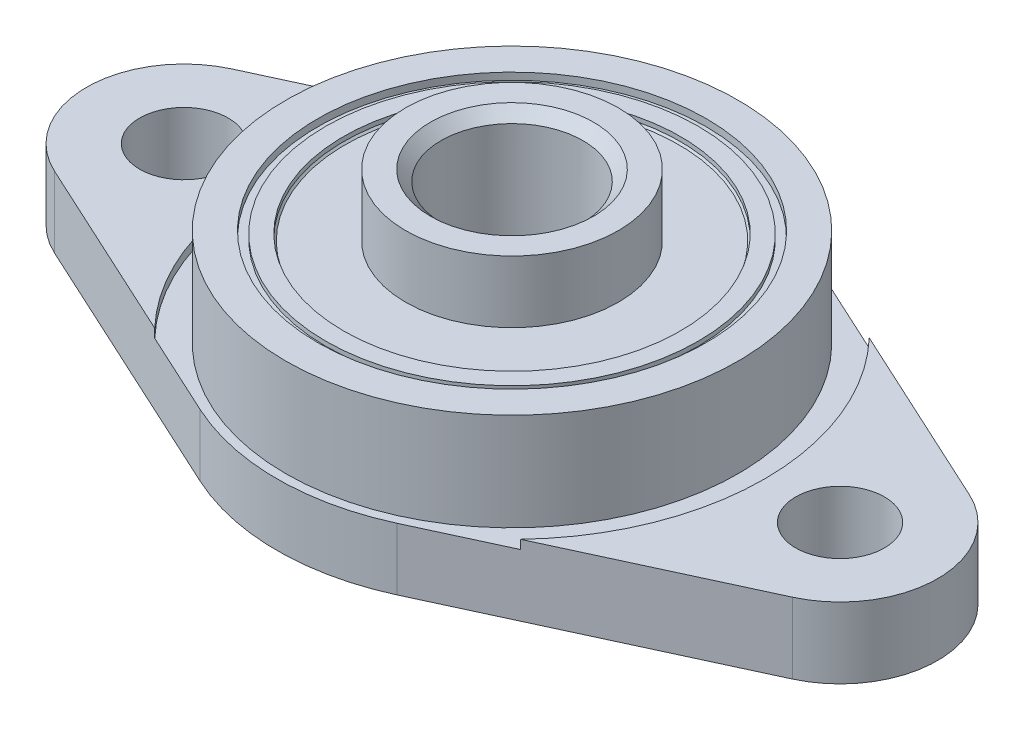
from build123d import *

# Parameters (mm, degrees)
SKETCH2_R               = 2.5
BOSS_EXTRUDE1_DEPTH     = 4
SKETCH3_R               = 14.25
CUT_EXTRUDE1_DEPTH      = 0.5
SKETCH4_R               = 12.75
BOSS_EXTRUDE2_DEPTH     = 5.5
CUT_EXTRUDE2_DEPTH      = 0.5
SKETCH6_R               = 10.95
CUT_EXTRUDE3_DEPTH      = 0.4
SKETCH7_R               = 10.5
BOSS_EXTRUDE3_DEPTH     = 0.25
SKETCH8_R               = 9.5
CUT_EXTRUDE4_DEPTH      = 0.35
BOSS_EXTRUDE4_START     = 0.25
SKETCH9_R               = 10.5
BOSS_EXTRUDE4_DEPTH     = 0.25
CUT_EXTRUDE5_START      = -0.35
SKETCH10_R              = 9.5
CUT_EXTRUDE5_DEPTH      = 0.35
SKETCH11_R              = 6
BOSS_EXTRUDE5_DEPTH     = 0.35
BOSS_EXTRUDE6_START     = 3.5
SKETCH12_R              = 6
BOSS_EXTRUDE6_DEPTH     = 3.5
CUT_EXTRUDE6_DEPTH      = 30.925950277
CUT_EXTRUDE6_DEPTH_BACK = 30.925950277
SKETCH13_R              = 4
CHAMFER1_SIZE           = 0.6
CHAMFER2_SIZE           = 0.6
CHAMFER3_SIZE           = 0.1


with BuildPart() as part:
    # Sketch2 → Boss-Extrude1 (new body)
    with BuildSketch(Plane(origin=(0, 0, 0), x_dir=(1, 0, 0), z_dir=(0, 1, 0))):
        with BuildLine():
            Line((-5.550675676, 12.031313293), (-20.804054054, 4.994130046))
            ThreePointArc((-20.804054054, 4.994130046), (-24, 0), (-20.804054054, -4.994130046))
            Line((-20.804054054, -4.994130046), (-5.550675676, -12.031313293))
            ThreePointArc((-5.550675676, -12.031313293), (0, -13.25), (5.550675676, -12.031313293))
            Line((5.550675676, -12.031313293), (20.804054054, -4.994130046))
            ThreePointArc((20.804054054, -4.994130046), (24, 0), (20.804054054, 4.994130046))
            Line((20.804054054, 4.994130046), (5.550675676, 12.031313293))
            ThreePointArc((5.550675676, 12.031313293), (0, 13.25), (-5.550675676, 12.031313293))
        make_face()
        with Locations(Location((-18.5, 0, 0), (0, 0, 270))):
            Circle(SKETCH2_R, mode=Mode.SUBTRACT)
        with Locations(Location((18.5, 0, 0), (0, 0, 90))):
            Circle(SKETCH2_R, mode=Mode.SUBTRACT)
    extrude(amount=BOSS_EXTRUDE1_DEPTH)

    # Sketch3 → Cut-Extrude1 (cut)
    with BuildSketch(Plane(origin=(0, 4, 0), x_dir=(1, 0, 0), z_dir=(0, 1, 0))):
        Circle(SKETCH3_R)
    extrude(amount=-CUT_EXTRUDE1_DEPTH, mode=Mode.SUBTRACT)

    # Sketch4 → Boss-Extrude2 (add)
    with BuildSketch(Plane(origin=(0, 3.5, 0), x_dir=(1, 0, 0), z_dir=(0, 1, 0))):
        with Locations(Location((0, 0, 0), (0, 0, 270))):
            Circle(SKETCH4_R)
    extrude(amount=BOSS_EXTRUDE2_DEPTH)

    # Sketch5 → Cut-Extrude2 (cut)
    with BuildSketch(Plane.XZ):
        with BuildLine():
            Line((4.838513514, -10.487673097), (16.48142728, -5.116186488))
            ThreePointArc((16.48142728, -5.116186488), (13, 0), (16.48142728, 5.116186488))
            Line((16.48142728, 5.116186488), (4.838513514, 10.487673097))
            ThreePointArc((4.838513514, 10.487673097), (0, 11.55), (-4.838513514, 10.487673097))
            Line((-4.838513514, 10.487673097), (-16.48142728, 5.116186488))
            ThreePointArc((-16.48142728, 5.116186488), (-13, 0), (-16.48142728, -5.116186488))
            Line((-16.48142728, -5.116186488), (-4.838513514, -10.487673097))
            ThreePointArc((-4.838513514, -10.487673097), (0, -11.55), (4.838513514, -10.487673097))
        make_face()
    extrude(amount=-CUT_EXTRUDE2_DEPTH, mode=Mode.SUBTRACT)

    # Sketch6 → Cut-Extrude3 (cut)
    with BuildSketch(Plane(origin=(0, 9, 0), x_dir=(1, 0, 0), z_dir=(0, 1, 0))):
        with Locations(Location((0, 0, 0), (0, 0, 270))):
            Circle(SKETCH6_R)
    extrude(amount=-CUT_EXTRUDE3_DEPTH, mode=Mode.SUBTRACT)

    # Sketch7 → Boss-Extrude3 (add)
    with BuildSketch(Plane(origin=(0, 8.6, 0), x_dir=(1, 0, 0), z_dir=(0, 1, 0))):
        with Locations(Location((0, 0, 0), (0, 0, 270))):
            Circle(SKETCH7_R)
    extrude(amount=BOSS_EXTRUDE3_DEPTH)

    # Sketch8 → Cut-Extrude4 (cut)
    with BuildSketch(Plane(origin=(0, 8.85, 0), x_dir=(1, 0, 0), z_dir=(0, 1, 0))):
        with Locations(Location((0, 0, 0), (0, 0, 270))):
            Circle(SKETCH8_R)
    extrude(amount=-CUT_EXTRUDE4_DEPTH, mode=Mode.SUBTRACT)

    # Sketch9 → Boss-Extrude4 (add)
    with BuildSketch(Plane.XZ.offset(-0.5).offset(BOSS_EXTRUDE4_START)):
        with Locations(Location((0, 0, 0), (0, 0, 90))):
            Circle(SKETCH9_R)
    extrude(amount=-BOSS_EXTRUDE4_DEPTH)

    # Sketch10 → Cut-Extrude5 (cut)
    with BuildSketch(Plane.XZ.offset(-0.25).offset(CUT_EXTRUDE5_START)):
        with Locations(Location((0, 0, 0), (0, 0, 90))):
            Circle(SKETCH10_R)
    extrude(amount=CUT_EXTRUDE5_DEPTH, mode=Mode.SUBTRACT)

    # Sketch11 → Boss-Extrude5 (add)
    with BuildSketch(Plane.XZ.offset(-0.6)):
        with Locations(Location((0, 0, 0), (0, 0, 270))):
            Circle(SKETCH11_R)
    extrude(amount=BOSS_EXTRUDE5_DEPTH)

    # Sketch12 → Boss-Extrude6 (add)
    with BuildSketch(Plane(origin=(0, 8.5, 0), x_dir=(1, 0, 0), z_dir=(0, 1, 0)).offset(BOSS_EXTRUDE6_START)):
        with Locations(Location((0, 0, 0), (0, 0, 90))):
            Circle(SKETCH12_R)
    extrude(amount=-BOSS_EXTRUDE6_DEPTH)

    # Sketch13 → Cut-Extrude6 (cut, two sides: drawn at the far end of the back side and taken through both)
    with BuildSketch(Plane(origin=(0, 12, 0), x_dir=(1, 0, 0), z_dir=(0, 1, 0)).offset(-CUT_EXTRUDE6_DEPTH_BACK)):
        with Locations(Location((0, 0, 0), (0, 0, 270))):
            Circle(SKETCH13_R)
    extrude(amount=CUT_EXTRUDE6_DEPTH + CUT_EXTRUDE6_DEPTH_BACK, mode=Mode.SUBTRACT)

    # Chamfer1
    chamfer1_edges = [part.edges().sort_by_distance(p)[0] for p in [
        (0, 12, -4),
    ]]
    chamfer(chamfer1_edges, length=CHAMFER1_SIZE)

    # Chamfer2
    chamfer2_edges = [part.edges().sort_by_distance(p)[0] for p in [
        (0, 0.25, -4),
    ]]
    chamfer(chamfer2_edges, length=CHAMFER2_SIZE)

    # Chamfer3
    chamfer3_edges = [part.edges().sort_by_distance(p)[0] for p in [
        (0, 0.6, -9.5),
        (0, 8.5, -9.5),
    ]]
    chamfer(chamfer3_edges, length=CHAMFER3_SIZE)


solid = part.part
